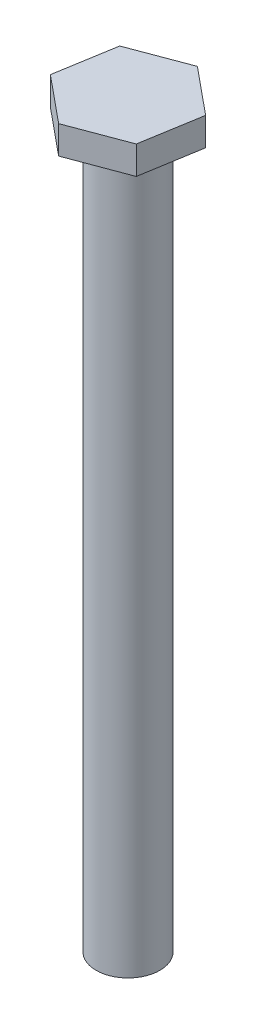
from build123d import *

# Parameters (mm, degrees)
SKETCH1_R   = 7.9375
SHAFT_DEPTH = 177.8
HEAD_DEPTH  = 7


with BuildPart() as part:
    # Sketch1 → Shaft (new body)
    with BuildSketch(Plane(origin=(0, 0, 0), x_dir=(1, 0, 0), z_dir=(0, 1, 0))):
        with Locations(Location((0, 0, 0), (0, 0, 270))):
            Circle(SKETCH1_R)
    extrude(amount=-SHAFT_DEPTH)

    # Sketch2 → Head (add)
    with BuildSketch(Plane(origin=(0, 0, 0), x_dir=(1, 0, 0), z_dir=(0, 1, 0))):
        Polygon((11.595031913, -9.533549616), (14.053812112, 5.274817386), (2.458780199, 14.808367002), (-11.595031913, 9.533549616), (-14.053812112, -5.274817386), (-2.458780199, -14.808367002), align=None)
    extrude(amount=HEAD_DEPTH)


solid = part.part
